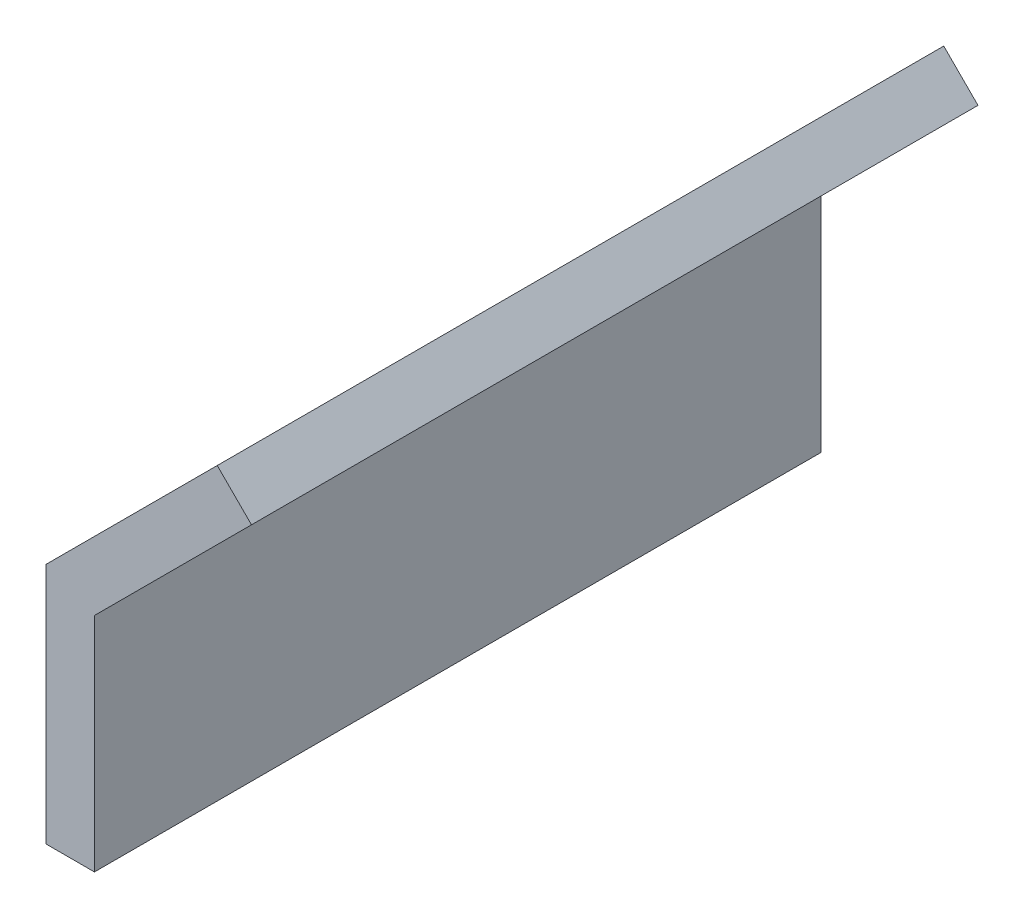
from build123d import *

# Parameters (mm, degrees)
BOSS_EXTRUDE1_DEPTH = 38.1


with BuildPart() as part:
    # Sketch1 → Boss-Extrude1 (new body)
    with BuildSketch(Plane.XY):
        Polygon((0, 0), (2.54, 0), (2.54, 11.647897552), (10.776307345, 19.884204897), (8.980256121, 21.680256121), (0, 12.7), align=None)
    extrude(amount=BOSS_EXTRUDE1_DEPTH)


solid = part.part
